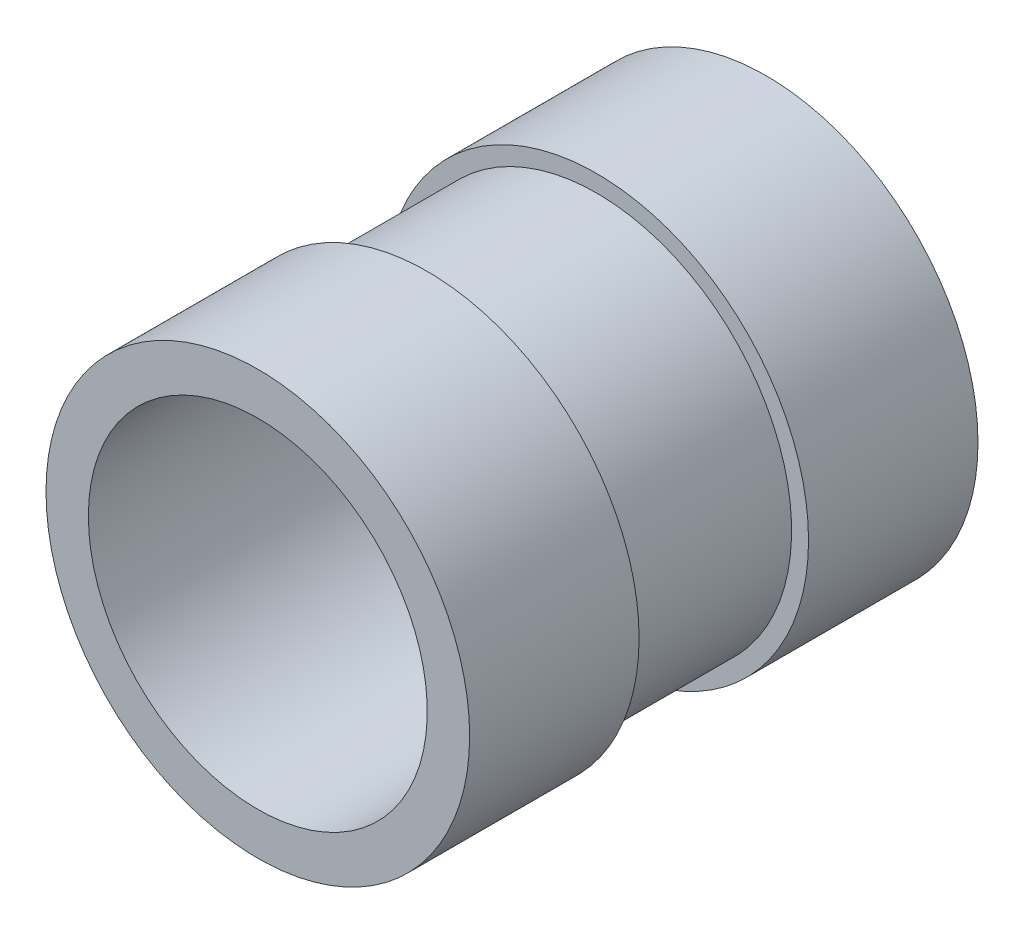
from build123d import *

# Parameters (mm, degrees)
SKETCH2_R          = 2
CUT_EXTRUDE1_DEPTH = 7.964194139


with BuildPart() as part:
    # Sketch1 → Revolve1 (revolve)
    with BuildSketch(Plane(origin=(0, 0, 0), x_dir=(1, 0, 0), z_dir=(0, 1, 0)), mode=Mode.PRIVATE) as revolve1_sk:
        Polygon((0, 0), (2.5, 0), (2.5, 2), (2.3, 2), (2.3, 4), (2.5, 4), (2.5, 6), (0, 6), align=None)
    revolve(revolve1_sk.sketch.rotate(Axis((0, 0, -11.944023292), (0, 0, 1)), 180), axis=Axis((0, 0, -11.944023292), (0, 0, 1)))

    # Sketch2 → Cut-Extrude1 (cut, through all)
    with BuildSketch(Plane(origin=(0, 0, -6), x_dir=(-1, 0, 0), z_dir=(0, 0, -1))):
        Circle(SKETCH2_R)
    extrude(amount=-CUT_EXTRUDE1_DEPTH, mode=Mode.SUBTRACT)


solid = part.part
